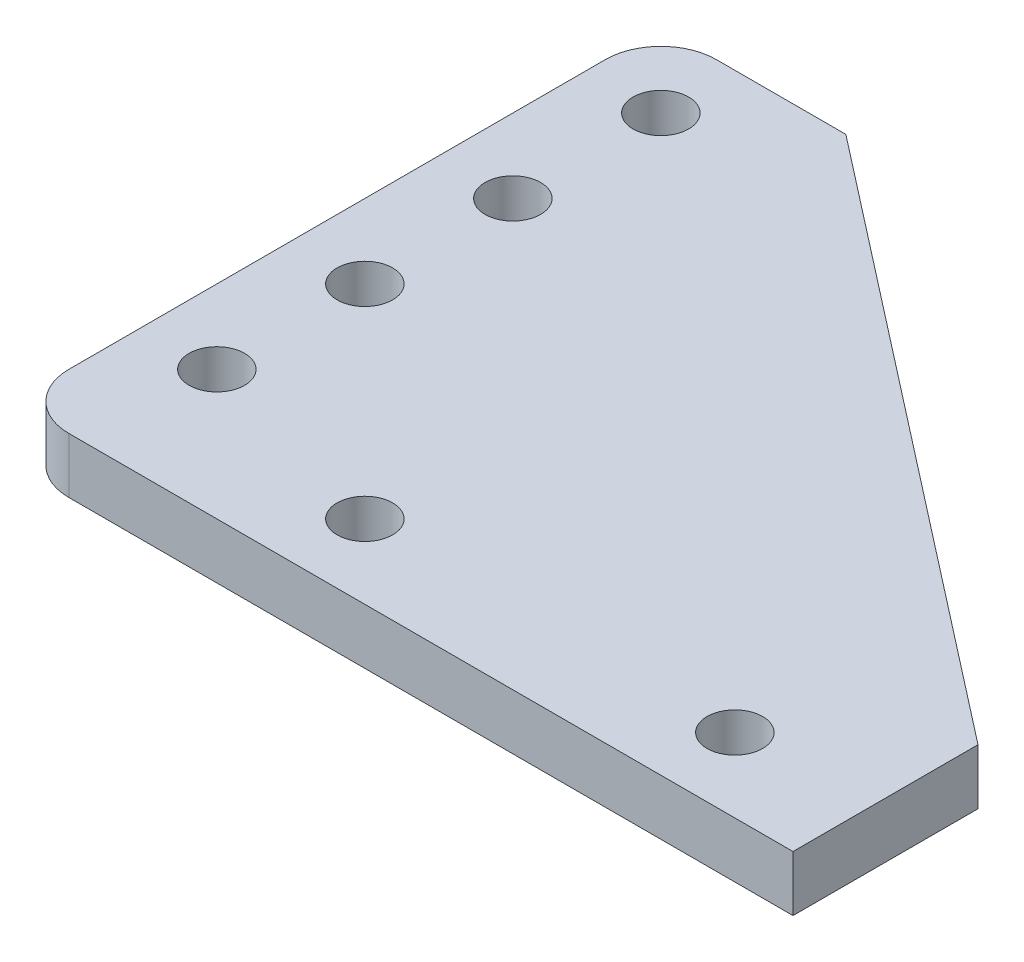
from build123d import *

# Parameters (mm, degrees)
SKETCH_1_R      = 1.5
EXTRUDE_1_DEPTH = 3
FILLET_1_R      = 3


with BuildPart() as part:
    # 草图1 → 凸台-拉伸1 (new body)
    with BuildSketch(Plane(origin=(0, 0, 0), x_dir=(1, 0, 0), z_dir=(0, 1, 0))):
        Polygon((0, 35), (0, 0), (42.142857143, 0), (42.142857143, 10), (10, 35), align=None)
        with Locations(Location((4, 7, 0), (0, 0, 270))):
            Circle(SKETCH_1_R, mode=Mode.SUBTRACT)
        with Locations(Location((15, 4, 0), (0, 0, 270))):
            Circle(SKETCH_1_R, mode=Mode.SUBTRACT)
        with Locations(Location((4, 15, 0), (0, 0, 270))):
            Circle(SKETCH_1_R, mode=Mode.SUBTRACT)
        with Locations(Location((35, 4, 0), (0, 0, 270))):
            Circle(SKETCH_1_R, mode=Mode.SUBTRACT)
        with Locations(Location((4, 23, 0), (0, 0, 270))):
            Circle(SKETCH_1_R, mode=Mode.SUBTRACT)
        with Locations(Location((4, 31, 0), (0, 0, 270))):
            Circle(SKETCH_1_R, mode=Mode.SUBTRACT)
    extrude(amount=EXTRUDE_1_DEPTH)

    # 圆角1
    fillet_1_edges = [part.edges().sort_by_distance(p)[0] for p in [
        (0, 1.5, 0),
        (0, 1.5, -35),
    ]]
    fillet(fillet_1_edges, radius=FILLET_1_R)


solid = part.part
